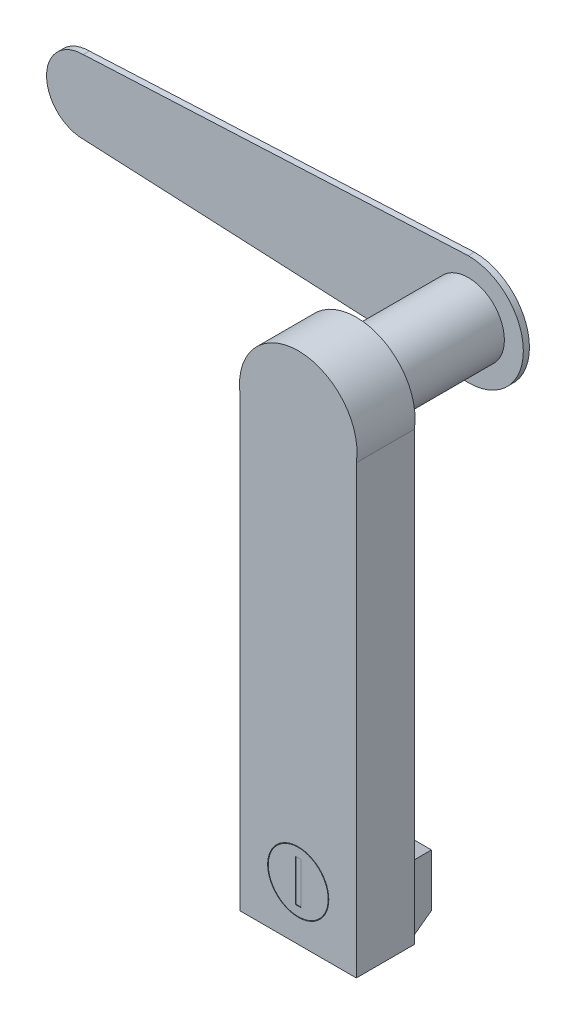
from build123d import *

# Parameters (mm, degrees)
EXTRUDE_1_DEPTH     = 9.5
SKETCH_2_W          = 18
SKETCH_2_H          = 11
EXTRUDE_2_DEPTH     = 4.5
EXTRUDE_2_TAPER     = 15
SKETCH_3_R          = 5
CUT_EXTRUDE_1_DEPTH = 5
SKETCH_4_R          = 4.9
EXTRUDE_3_DEPTH     = 5
SKETCH_5_W          = 0.978234864
SKETCH_5_H          = 6.839106706
CUT_EXTRUDE_2_DEPTH = 0.1
SKETCH_7_R          = 5.9
EXTRUDE_4_DEPTH     = 18.5
EXTRUDE_5_DEPTH     = 1


with BuildPart() as part:
    # 草圖1 → 伸長1 (new body)
    with BuildSketch(Plane.XY):
        with BuildLine():
            Line((-9.5, 36), (-9.5, -37))
            Line((-9.5, -37), (9.5, -37))
            Line((9.5, -37), (9.5, 36))
            ThreePointArc((9.5, 36), (0, 47.117692031), (-9.5, 36))
        make_face()
    extrude(amount=-EXTRUDE_1_DEPTH)

    # 草圖2 → 伸長2 (add)
    with BuildSketch(Plane(origin=(0, 0, -9.5), x_dir=(-1, 0, 0), z_dir=(0, 0, -1))):
        with Locations((0, -31)):
            Rectangle(SKETCH_2_W, SKETCH_2_H)
    extrude(amount=EXTRUDE_2_DEPTH, taper=EXTRUDE_2_TAPER)

    # 草圖3 → 除料-伸長1 (cut)
    with BuildSketch(Plane.XY):
        with Locations((0, -28.150570544)):
            Circle(SKETCH_3_R)
    extrude(amount=-CUT_EXTRUDE_1_DEPTH, mode=Mode.SUBTRACT)

    # 草圖4 → 伸長3 (add)
    with BuildSketch(Plane.XY.offset(-5)):
        with Locations((0, -28.150570544)):
            Circle(SKETCH_4_R)
    extrude(amount=EXTRUDE_3_DEPTH)

    # 草圖5 → 除料-伸長2 (cut)
    with BuildSketch(Plane.XY):
        with Locations((0, -28.150570544)):
            Rectangle(SKETCH_5_W, SKETCH_5_H)
    extrude(amount=-CUT_EXTRUDE_2_DEPTH, mode=Mode.SUBTRACT)

    # 草圖7 → 伸長4 (add)
    with BuildSketch(Plane(origin=(0, 0, -9.5), x_dir=(-1, 0, 0), z_dir=(0, 0, -1))):
        with Locations(Location((0.17562961, 37.497796385, 0), (0, 0, 180))):
            Circle(SKETCH_7_R)
    extrude(amount=EXTRUDE_4_DEPTH)

    # 草圖8 → 伸長5 (add)
    with BuildSketch(Plane(origin=(0, 0, -28), x_dir=(-1, 0, 0), z_dir=(0, 0, -1))):
        with BuildLine():
            Line((0.17562961, 46.497796385), (63.17562961, 43.497796385))
            ThreePointArc((63.17562961, 43.497796385), (69.17562961, 37.497796385), (63.17562961, 31.497796385))
            Line((63.17562961, 31.497796385), (0.17562961, 28.497796385))
            ThreePointArc((0.17562961, 28.497796385), (-8.82437039, 37.497796385), (0.17562961, 46.497796385))
        make_face()
    extrude(amount=EXTRUDE_5_DEPTH)


solid = part.part
